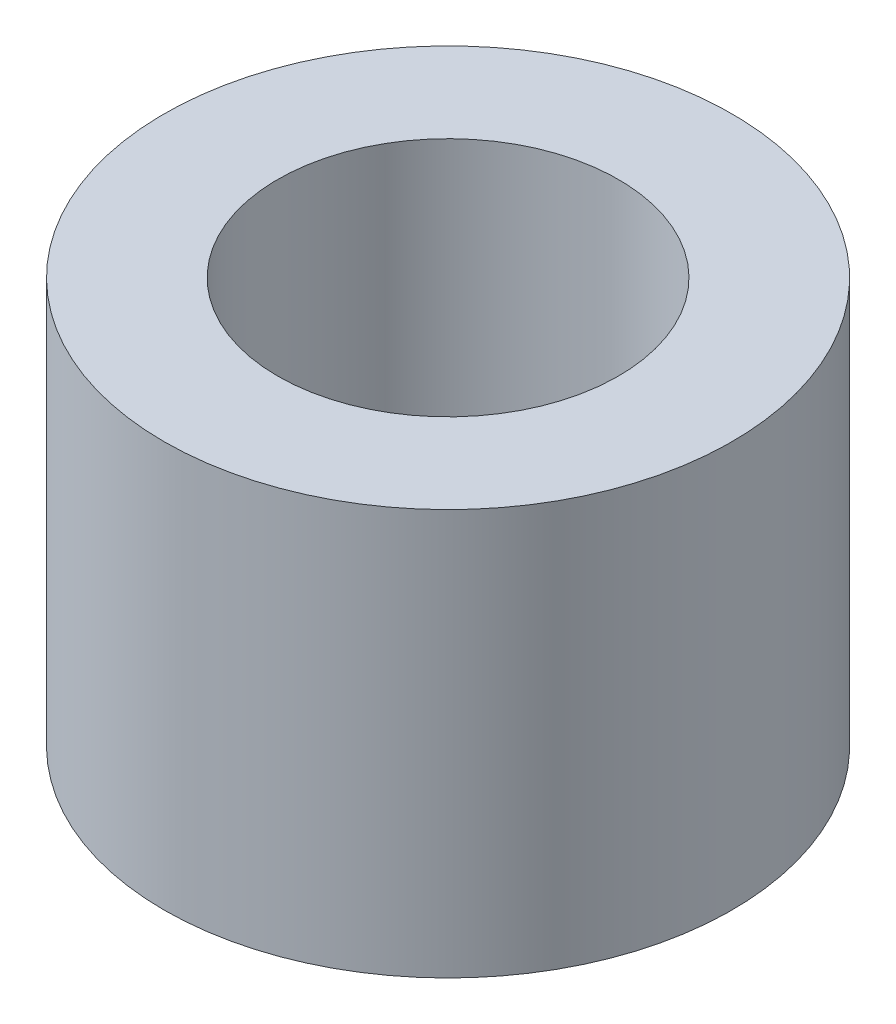
from build123d import *

# Parameters (mm, degrees)
SKETCH_1_R      = 3.5
SKETCH_1_R_2    = 2.1
EXTRUDE_1_DEPTH = 5


with BuildPart() as part:
    # 草图1 → 凸台-拉伸1 (new body)
    with BuildSketch(Plane(origin=(0, 0, 0), x_dir=(1, 0, 0), z_dir=(0, 1, 0))):
        with Locations(Location((0, 0, 0), (0, 0, 270))):
            Circle(SKETCH_1_R)
        with Locations(Location((0, 0, 0), (0, 0, 270))):
            Circle(SKETCH_1_R_2, mode=Mode.SUBTRACT)
    extrude(amount=EXTRUDE_1_DEPTH)


solid = part.part
